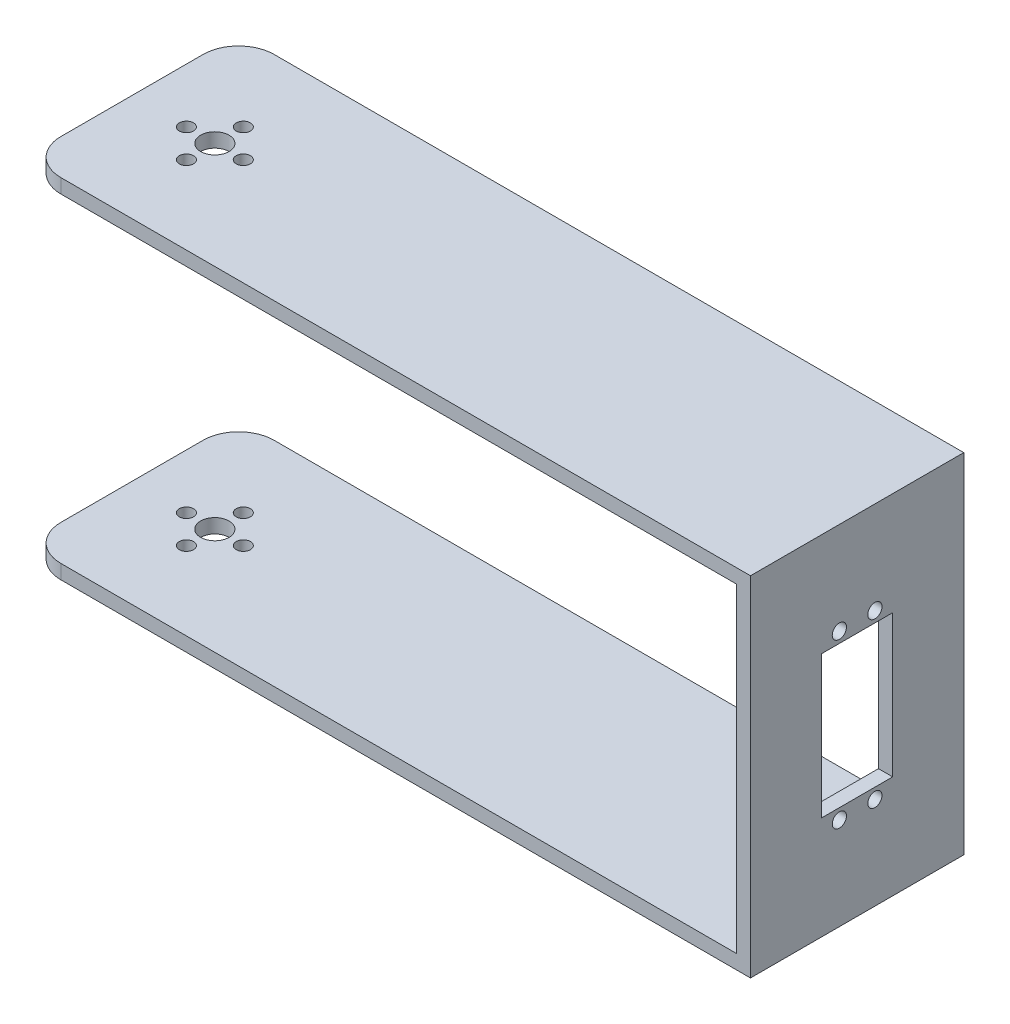
from build123d import *

# Parameters (mm, degrees)
EKSTR_ZYON_NCE1_DEPTH = 60
RADYUS1_R             = 10
KES_EKSTR_ZYON1_REACH = 236.137
IZIM2_R               = 4
IZIM2_R_2             = 2
KES_EKSTR_ZYON2_REACH = 234.491
IZIM3_R               = 2
IZIM3_W               = 20
IZIM3_H               = 40


with BuildPart() as part:
    # Çizim1 → Ekstrüzyon-İnce1 (new body)
    with BuildSketch(Plane.XY):
        Polygon((0, 0), (200, 0), (200, 90), (0, 90), (0, 94), (204, 94), (204, -4), (0, -4), align=None)
    extrude(amount=EKSTR_ZYON_NCE1_DEPTH)

    # Radyus1
    radyus1_edges = [part.edges().sort_by_distance(p)[0] for p in [
        (0, -2, 60),
        (0, 92, 60),
        (0, -2, 0),
        (0, 92, 0),
    ]]
    fillet(radyus1_edges, radius=RADYUS1_R)

    # Çizim2 → Kes-Ekstrüzyon1 (cut, up to next)
    with BuildSketch(Plane(origin=(0, 94, 0), x_dir=(1, 0, 0), z_dir=(0, 1, 0)), mode=Mode.PRIVATE) as kes_ekstr_zyon1_sk1:
        with Locations(Location((23.318126504, -30, 0), (0, 0, 270))):
            Circle(IZIM2_R)
    kes_ekstr_zyon1_tool1 = extrude(kes_ekstr_zyon1_sk1.sketch, amount=-KES_EKSTR_ZYON1_REACH, mode=Mode.PRIVATE) & part.part
    # Çizim2 → Kes-Ekstrüzyon1 (cut, up to next)
    with BuildSketch(Plane(origin=(0, 94, 0), x_dir=(1, 0, 0), z_dir=(0, 1, 0)), mode=Mode.PRIVATE) as kes_ekstr_zyon1_sk2:
        with Locations(Location((23.318126504, -22, 0), (0, 0, 270))):
            Circle(IZIM2_R_2)
    kes_ekstr_zyon1_tool2 = extrude(kes_ekstr_zyon1_sk2.sketch, amount=-KES_EKSTR_ZYON1_REACH, mode=Mode.PRIVATE) & part.part
    # Çizim2 → Kes-Ekstrüzyon1 (cut, up to next)
    with BuildSketch(Plane(origin=(0, 94, 0), x_dir=(1, 0, 0), z_dir=(0, 1, 0)), mode=Mode.PRIVATE) as kes_ekstr_zyon1_sk3:
        with Locations(Location((23.318126504, -38, 0), (0, 0, 270))):
            Circle(IZIM2_R_2)
    kes_ekstr_zyon1_tool3 = extrude(kes_ekstr_zyon1_sk3.sketch, amount=-KES_EKSTR_ZYON1_REACH, mode=Mode.PRIVATE) & part.part
    # Çizim2 → Kes-Ekstrüzyon1 (cut, up to next)
    with BuildSketch(Plane(origin=(0, 94, 0), x_dir=(1, 0, 0), z_dir=(0, 1, 0)), mode=Mode.PRIVATE) as kes_ekstr_zyon1_sk4:
        with Locations(Location((31.318126504, -30, 0), (0, 0, 270))):
            Circle(IZIM2_R_2)
    kes_ekstr_zyon1_tool4 = extrude(kes_ekstr_zyon1_sk4.sketch, amount=-KES_EKSTR_ZYON1_REACH, mode=Mode.PRIVATE) & part.part
    # Çizim2 → Kes-Ekstrüzyon1 (cut, up to next)
    with BuildSketch(Plane(origin=(0, 94, 0), x_dir=(1, 0, 0), z_dir=(0, 1, 0)), mode=Mode.PRIVATE) as kes_ekstr_zyon1_sk5:
        with Locations(Location((15.318126504, -30, 0), (0, 0, 270))):
            Circle(IZIM2_R_2)
    kes_ekstr_zyon1_tool5 = extrude(kes_ekstr_zyon1_sk5.sketch, amount=-KES_EKSTR_ZYON1_REACH, mode=Mode.PRIVATE) & part.part
    kes_ekstr_zyon1_1 = kes_ekstr_zyon1_tool1.solids().sort_by_distance((23.318127, 94, 30))[0]
    add(kes_ekstr_zyon1_1, mode=Mode.SUBTRACT)
    kes_ekstr_zyon1_2 = kes_ekstr_zyon1_tool2.solids().sort_by_distance((23.318127, 94, 22))[0]
    add(kes_ekstr_zyon1_2, mode=Mode.SUBTRACT)
    kes_ekstr_zyon1_3 = kes_ekstr_zyon1_tool3.solids().sort_by_distance((23.318127, 94, 38))[0]
    add(kes_ekstr_zyon1_3, mode=Mode.SUBTRACT)
    kes_ekstr_zyon1_4 = kes_ekstr_zyon1_tool4.solids().sort_by_distance((31.318127, 94, 30))[0]
    add(kes_ekstr_zyon1_4, mode=Mode.SUBTRACT)
    kes_ekstr_zyon1_5 = kes_ekstr_zyon1_tool5.solids().sort_by_distance((15.318127, 94, 30))[0]
    add(kes_ekstr_zyon1_5, mode=Mode.SUBTRACT)
    kes_ekstr_zyon1 = kes_ekstr_zyon1_1 + kes_ekstr_zyon1_2 + kes_ekstr_zyon1_3 + kes_ekstr_zyon1_4 + kes_ekstr_zyon1_5  # Kes-Ekstrüzyon1 as one shape, for the pattern or mirror that repeats it

    # Aynalama1: Kes-Ekstrüzyon1 across plane
    add(kes_ekstr_zyon1.mirror(Plane.ZX.offset(45)), mode=Mode.SUBTRACT)

    # Çizim3 → Kes-Ekstrüzyon2 (cut, up to next)
    with BuildSketch(Plane(origin=(204, 0, 0), x_dir=(0, 0, -1), z_dir=(1, 0, 0)), mode=Mode.PRIVATE) as kes_ekstr_zyon2_sk1:
        with Locations((-25, 68)):
            Circle(IZIM3_R)
    kes_ekstr_zyon2_tool1 = extrude(kes_ekstr_zyon2_sk1.sketch, amount=-KES_EKSTR_ZYON2_REACH, mode=Mode.PRIVATE) & part.part
    # Çizim3 → Kes-Ekstrüzyon2 (cut, up to next)
    with BuildSketch(Plane(origin=(204, 0, 0), x_dir=(0, 0, -1), z_dir=(1, 0, 0)), mode=Mode.PRIVATE) as kes_ekstr_zyon2_sk2:
        with Locations(Location((-35, 68, 0), (0, 0, 180))):
            Circle(IZIM3_R)
    kes_ekstr_zyon2_tool2 = extrude(kes_ekstr_zyon2_sk2.sketch, amount=-KES_EKSTR_ZYON2_REACH, mode=Mode.PRIVATE) & part.part
    # Çizim3 → Kes-Ekstrüzyon2 (cut, up to next)
    with BuildSketch(Plane(origin=(204, 0, 0), x_dir=(0, 0, -1), z_dir=(1, 0, 0)), mode=Mode.PRIVATE) as kes_ekstr_zyon2_sk3:
        with Locations(Location((-25, 22, 0), (0, 0, 180))):
            Circle(IZIM3_R)
    kes_ekstr_zyon2_tool3 = extrude(kes_ekstr_zyon2_sk3.sketch, amount=-KES_EKSTR_ZYON2_REACH, mode=Mode.PRIVATE) & part.part
    # Çizim3 → Kes-Ekstrüzyon2 (cut, up to next)
    with BuildSketch(Plane(origin=(204, 0, 0), x_dir=(0, 0, -1), z_dir=(1, 0, 0)), mode=Mode.PRIVATE) as kes_ekstr_zyon2_sk4:
        with Locations((-35, 22)):
            Circle(IZIM3_R)
    kes_ekstr_zyon2_tool4 = extrude(kes_ekstr_zyon2_sk4.sketch, amount=-KES_EKSTR_ZYON2_REACH, mode=Mode.PRIVATE) & part.part
    # Çizim3 → Kes-Ekstrüzyon2 (cut, up to next)
    with BuildSketch(Plane(origin=(204, 0, 0), x_dir=(0, 0, -1), z_dir=(1, 0, 0)), mode=Mode.PRIVATE) as kes_ekstr_zyon2_sk5:
        with Locations((-30, 45)):
            Rectangle(IZIM3_W, IZIM3_H)
    kes_ekstr_zyon2_tool5 = extrude(kes_ekstr_zyon2_sk5.sketch, amount=-KES_EKSTR_ZYON2_REACH, mode=Mode.PRIVATE) & part.part
    add(kes_ekstr_zyon2_tool1.solids().sort_by_distance((204, 68, 25))[0], mode=Mode.SUBTRACT)
    add(kes_ekstr_zyon2_tool2.solids().sort_by_distance((204, 68, 35))[0], mode=Mode.SUBTRACT)
    add(kes_ekstr_zyon2_tool3.solids().sort_by_distance((204, 22, 25))[0], mode=Mode.SUBTRACT)
    add(kes_ekstr_zyon2_tool4.solids().sort_by_distance((204, 22, 35))[0], mode=Mode.SUBTRACT)
    add(kes_ekstr_zyon2_tool5.solids().sort_by_distance((204, 45, 30))[0], mode=Mode.SUBTRACT)


solid = part.part
